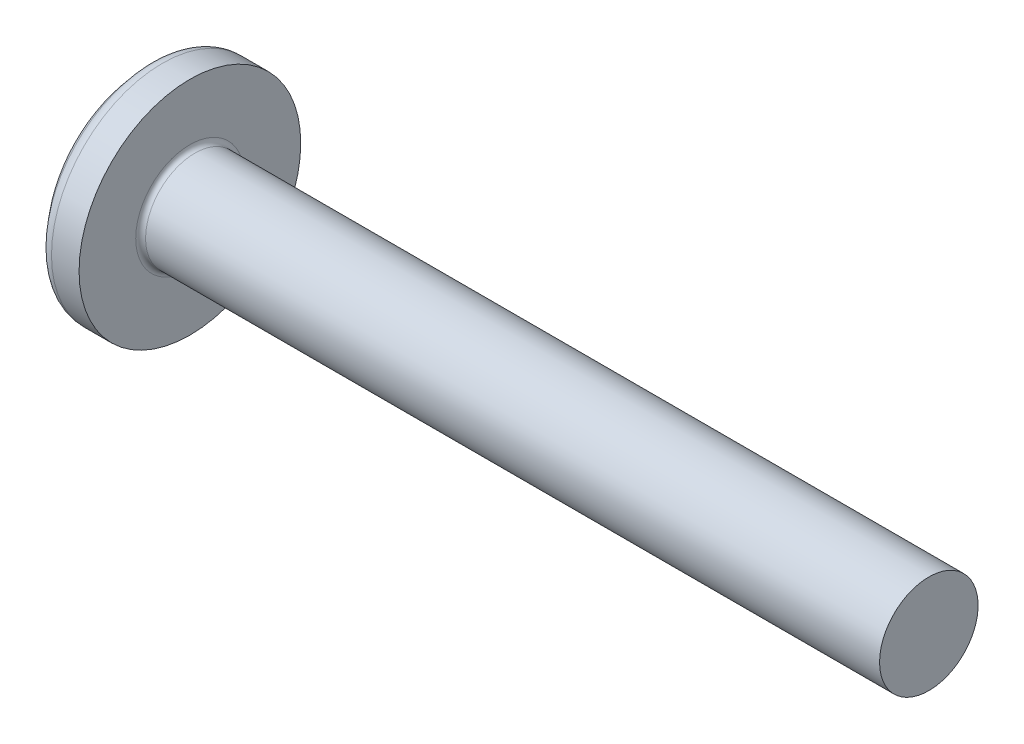
from build123d import *

# Parameters (mm, degrees)
FILLET1_R    = 0.1
RECPAT_COUNT = 2
RECPAT_ANGLE = 90


with BuildPart() as part:
    # BodySke → Base-Revolve (revolve)
    with BuildSketch(Plane.XY, mode=Mode.PRIVATE) as base_revolve_sk:
        with BuildLine():
            Line((1.6, 1), (1.6, 2.25))
            Line((1.6, 2.25), (1.040254645, 2.25))
            ThreePointArc((1.040254645, 2.25), (0.931542827, 2.227147204), (0.841233742, 2.162457338))
            ThreePointArc((0.841233742, 2.162457338), (0.217714632, 1.16016119), (0, 0))
            Line((0, 0), (16.6, 0))
            Line((16.6, 0), (16.6, 1))
            Line((16.6, 1), (1.6, 1))
        make_face()
    revolve(base_revolve_sk.sketch.rotate(Axis((-25.4, 0, 0), (1, 0, 0)), 90), axis=Axis((-25.4, 0, 0), (1, 0, 0)))

    # Fillet1
    fillet1_edges = [part.edges().sort_by_distance(p)[0] for p in [
        (1.6, 0, -1),
    ]]
    fillet(fillet1_edges, radius=FILLET1_R)

    # Sketch3 → Recess section 0
    with BuildSketch(Plane(origin=(0, 0, 0), x_dir=(0, 0, -1), z_dir=(1, 0, 0))):
        with BuildLine():
            Line((0.37, -0.95), (-0.37, -0.95))
            Line((-0.37, -0.95), (-0.37, 0.95))
            Line((-0.37, 0.95), (0.37, 0.95))
            Line((0.37, 0.95), (0.37, -0.95))
        make_face()
    # Sketch4 → Recess section 1
    with BuildSketch(Plane(origin=(1.75, 0, 0), x_dir=(0, 0, -1), z_dir=(1, 0, 0))):
        with BuildLine():
            Line((0.37, -0.527482216), (-0.37, -0.527482216))
            Line((-0.37, -0.527482216), (-0.37, 0.527482216))
            Line((-0.37, 0.527482216), (0.37, 0.527482216))
            Line((0.37, 0.527482216), (0.37, -0.527482216))
        make_face()
    recess = loft(mode=Mode.SUBTRACT)

    # RecPat: Recess ×2 about axis
    recpat_axis = Axis((0, 0, 0), (1, 0, 0))
    for i in range(1, RECPAT_COUNT):
        add(recess.rotate(recpat_axis, i * RECPAT_ANGLE / (RECPAT_COUNT - 1)), mode=Mode.SUBTRACT)

    # RecCorSke → RecessCore (revolve, cut)
    with BuildSketch(Plane.XY, mode=Mode.PRIVATE) as recesscore_sk:
        Polygon((0, 0), (0, 0.678371921), (1.75, 0.556), (1.930655351, 0), align=None)
    revolve(recesscore_sk.sketch.rotate(Axis((-3.175, 0, 0), (1, 0, 0)), 22.071251507), axis=Axis((-3.175, 0, 0), (1, 0, 0)), mode=Mode.SUBTRACT)


solid = part.part
